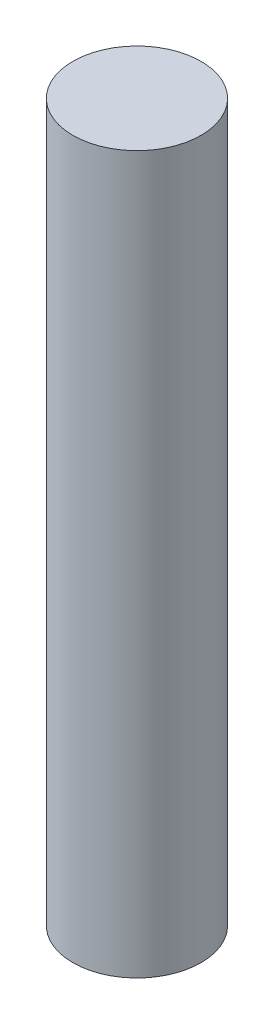
from build123d import *

# Parameters (mm, degrees)
SKETCH1_R           = 5
BOSS_EXTRUDE1_DEPTH = 55.88


with BuildPart() as part:
    # Sketch1 → Boss-Extrude1 (new body)
    with BuildSketch(Plane(origin=(0, 0, 0), x_dir=(1, 0, 0), z_dir=(0, 1, 0))):
        with Locations(Location((0, 0, 0), (0, 0, 270))):
            Circle(SKETCH1_R)
    extrude(amount=BOSS_EXTRUDE1_DEPTH)


solid = part.part
